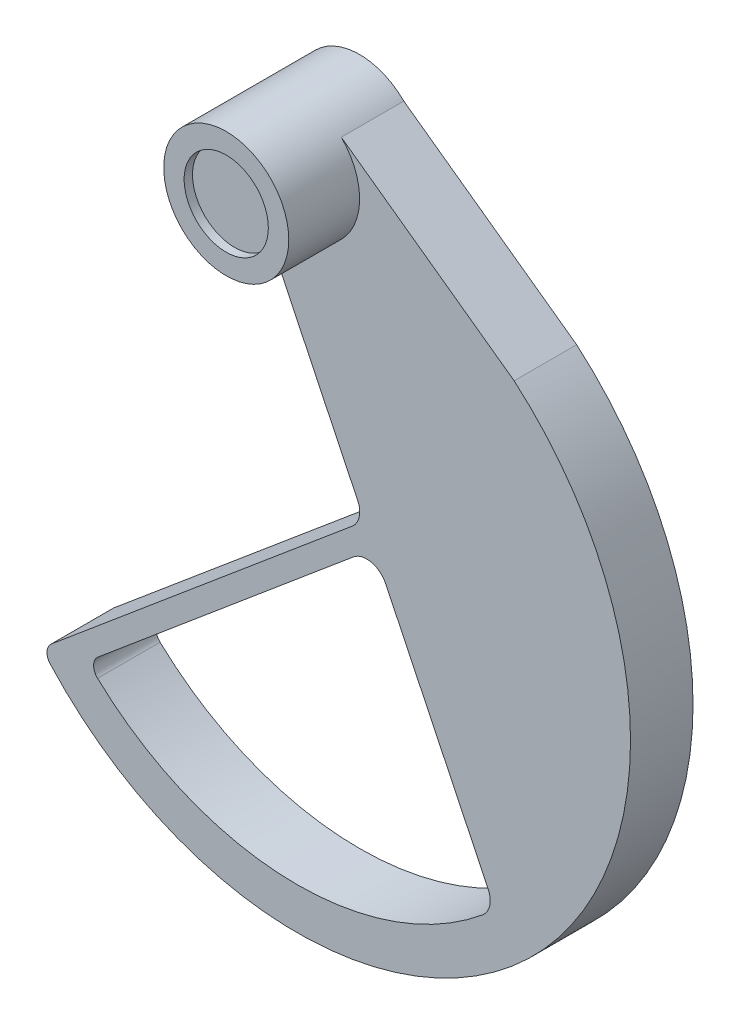
from build123d import *

# Parameters (mm, degrees)
EXTRUDE_1_DEPTH     = 15
SKETCH_5_R          = 15
EXTRUDE_2_DEPTH     = 17
SKETCH_7_R          = 10.1
CUT_EXTRUDE_1_DEPTH = 2


with BuildPart() as part:
    # ｽｹｯﾁ4 → ﾎﾞｽ - 押し出し1 (new body)
    with BuildSketch(Plane.XY):
        with BuildLine():
            Line((-53.623111018, -124.995132678), (-58.940636287, -129.45706617))
            ThreePointArc((-58.940636287, -129.45706617), (-60.005384698, -131.552012131), (-59.233530865, -133.771635843))
            ThreePointArc((-59.233530865, -133.771635843), (57.362306223, -135.763481103), (52.076178918, -19.270504783))
            Line((52.076178918, -19.270504783), (10.606601718, 10.606601718))
            ThreePointArc((10.606601718, 10.606601718), (-10.606601718, 10.606601718), (-10.606601718, -10.606601718))
            Line((-10.606601718, -10.606601718), (14.536280154, -62.889638219))
            ThreePointArc((14.536280154, -62.889638219), (14.918089499, -66.109676181), (13.244185189, -68.886809092))
            Line((13.244185189, -68.886809092), (-53.623111018, -124.995132678))
        make_face()
        with BuildLine():
            Line((21.232400696, -76.813798404), (45.844843506, -127.993820346))
            ThreePointArc((45.844843506, -127.993820346), (46.221944165, -131.235480845), (44.518718993, -134.019289696))
            ThreePointArc((44.518718993, -134.019289696), (-2.231208213, -149.964431749), (-47.870174388, -131.072951785))
            ThreePointArc((-47.870174388, -131.072951785), (-48.817477846, -128.802229421), (-47.747678417, -126.586582094))
            Line((-47.747678417, -126.586582094), (13.511229465, -75.151532228))
            ThreePointArc((13.511229465, -75.151532228), (17.77869109, -74.092739753), (21.232400696, -76.813798404))
        make_face(mode=Mode.SUBTRACT)
    extrude(amount=EXTRUDE_1_DEPTH)

    # ｽｹｯﾁ5 → ﾎﾞｽ - 押し出し2 (add)
    with BuildSketch(Plane.XY.offset(15)):
        with Locations(Location((0, 0, 0), (0, 0, 225))):
            Circle(SKETCH_5_R)
    extrude(amount=EXTRUDE_2_DEPTH)

    # ｽｹｯﾁ7 → ｶｯﾄ - 押し出し1 (cut)
    with BuildSketch(Plane.XY.offset(32)):
        Circle(SKETCH_7_R)
    extrude(amount=-CUT_EXTRUDE_1_DEPTH, mode=Mode.SUBTRACT)


solid = part.part
